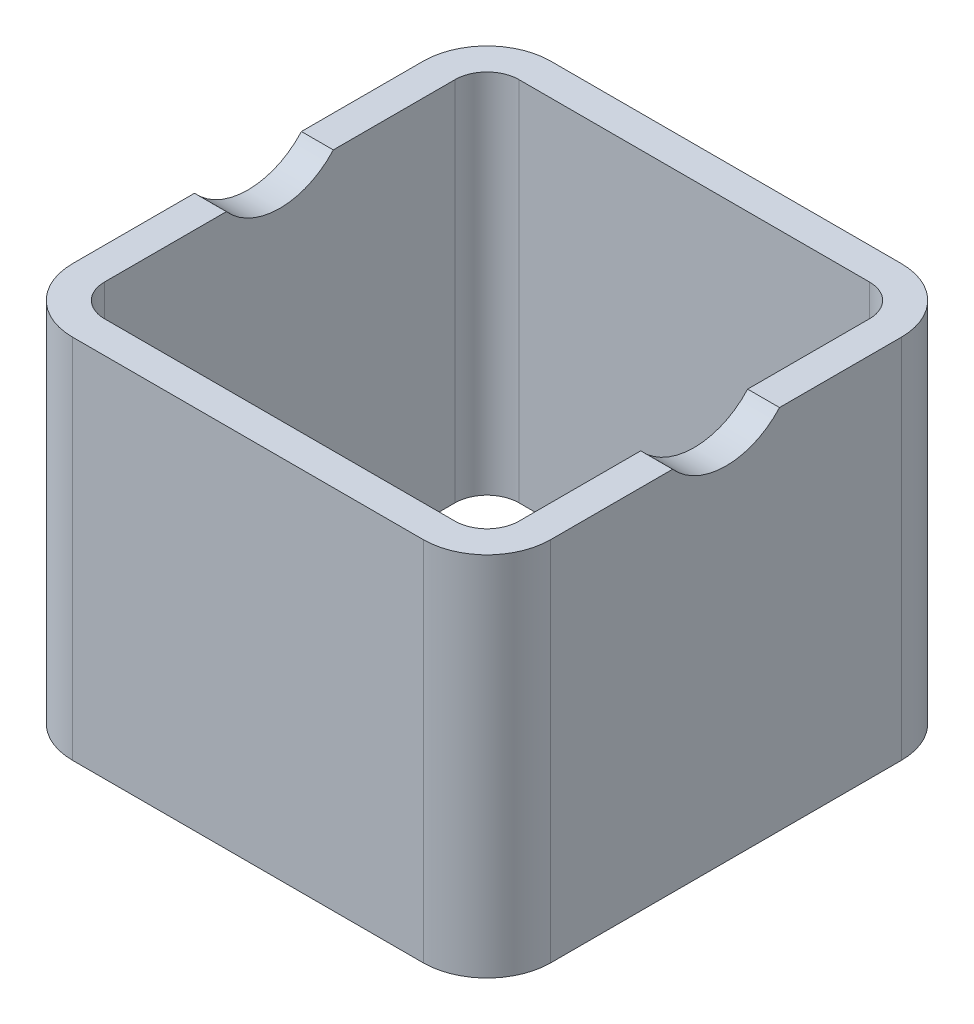
from build123d import *

# Parameters (mm, degrees)
EXTRUDE_1_DEPTH          = 11.5
CUT_EXTRUDE_1_DEPTH      = 25.129857024
CUT_EXTRUDE_1_DEPTH_BACK = 25.129857024
SKETCH_2_R               = 4.5


with BuildPart() as part:
    # 草图1 → 凸台-拉伸1 (new, symmetric)
    with BuildSketch(Plane(origin=(0, 0, 0), x_dir=(1, 0, 0), z_dir=(0, 1, 0))):
        with BuildLine():
            Line((-11, -15), (11, -15))
            ThreePointArc((11, -15), (13.828427125, -13.828427125), (15, -11))
            Line((15, -11), (15, 11))
            ThreePointArc((15, 11), (13.828427125, 13.828427125), (11, 15))
            Line((11, 15), (-11, 15))
            ThreePointArc((-11, 15), (-13.828427125, 13.828427125), (-15, 11))
            Line((-15, 11), (-15, -11))
            ThreePointArc((-15, -11), (-13.828427125, -13.828427125), (-11, -15))
        make_face()
        with BuildLine():
            Line((-11, -13), (11, -13))
            ThreePointArc((11, -13), (12.414213562, -12.414213562), (13, -11))
            Line((13, -11), (13, 11))
            ThreePointArc((13, 11), (12.414213562, 12.414213562), (11, 13))
            Line((11, 13), (-11, 13))
            ThreePointArc((-11, 13), (-12.414213562, 12.414213562), (-13, 11))
            Line((-13, 11), (-13, -11))
            ThreePointArc((-13, -11), (-12.414213562, -12.414213562), (-11, -13))
        make_face(mode=Mode.SUBTRACT)
    extrude(amount=EXTRUDE_1_DEPTH, both=True)

    # 草图2 → 切除-拉伸1 (cut, two sides: drawn at the far end of the back side and taken through both)
    with BuildSketch(Plane(origin=(0, 0, 0), x_dir=(0, 0, -1), z_dir=(1, 0, 0)).offset(-CUT_EXTRUDE_1_DEPTH_BACK)):
        with Locations((0, 14.5)):
            Circle(SKETCH_2_R)
    extrude(amount=CUT_EXTRUDE_1_DEPTH + CUT_EXTRUDE_1_DEPTH_BACK, mode=Mode.SUBTRACT)


solid = part.part
